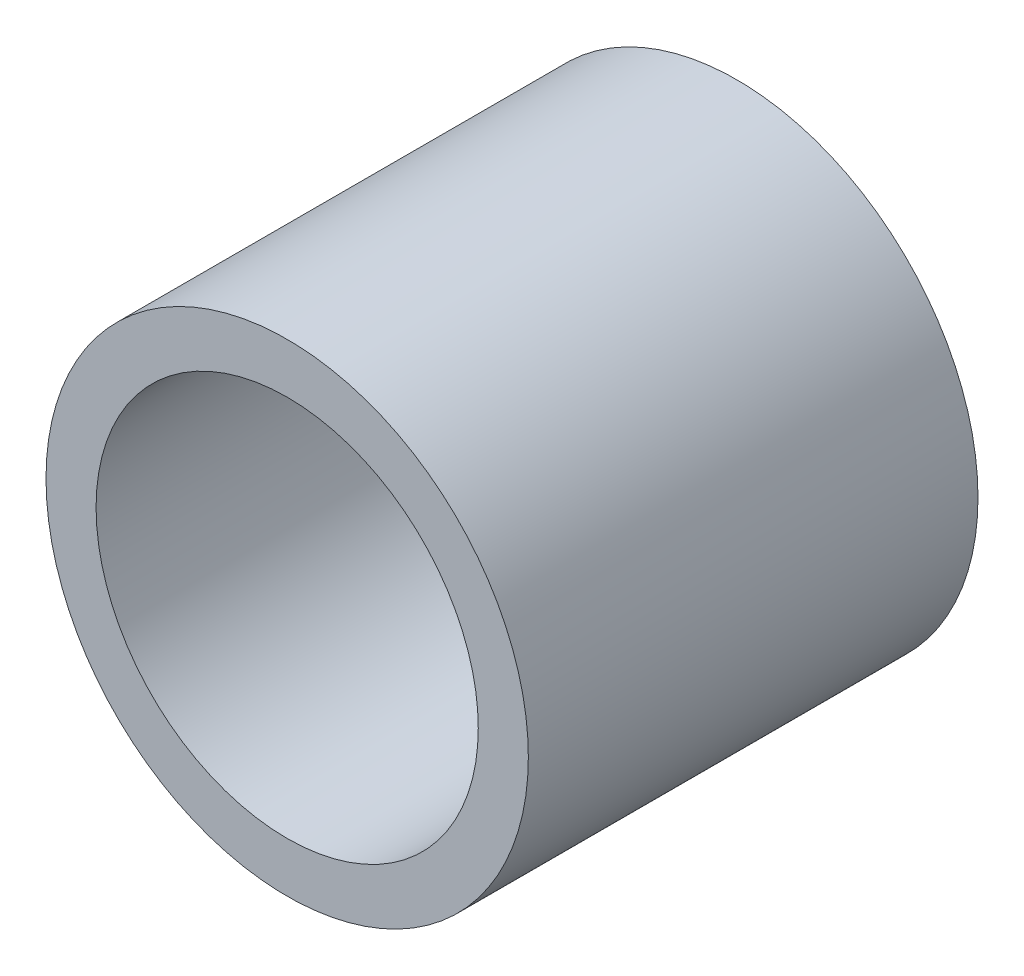
from build123d import *

# Parameters (mm, degrees)
SKETCH1_R           = 14.986
BOSS_EXTRUDE1_DEPTH = 30.988
SKETCH2_R           = 11.8745
CUT_EXTRUDE1_DEPTH  = 29.0322
SKETCH3_R           = 14.986
SKETCH3_R_2         = 11.8745
CUT_EXTRUDE2_DEPTH  = 3.048


with BuildPart() as part:
    # Sketch1 → Boss-Extrude1 (new body)
    with BuildSketch(Plane.XY):
        Circle(SKETCH1_R)
    extrude(amount=BOSS_EXTRUDE1_DEPTH)

    # Sketch2 → Cut-Extrude1 (cut)
    with BuildSketch(Plane.XY.offset(30.988)):
        Circle(SKETCH2_R)
    extrude(amount=-CUT_EXTRUDE1_DEPTH, mode=Mode.SUBTRACT)

    # Sketch3 → Cut-Extrude2 (cut)
    with BuildSketch(Plane.XY.offset(30.988)):
        Circle(SKETCH3_R)
        Circle(SKETCH3_R_2, mode=Mode.SUBTRACT)
    extrude(amount=-CUT_EXTRUDE2_DEPTH, mode=Mode.SUBTRACT)


solid = part.part
